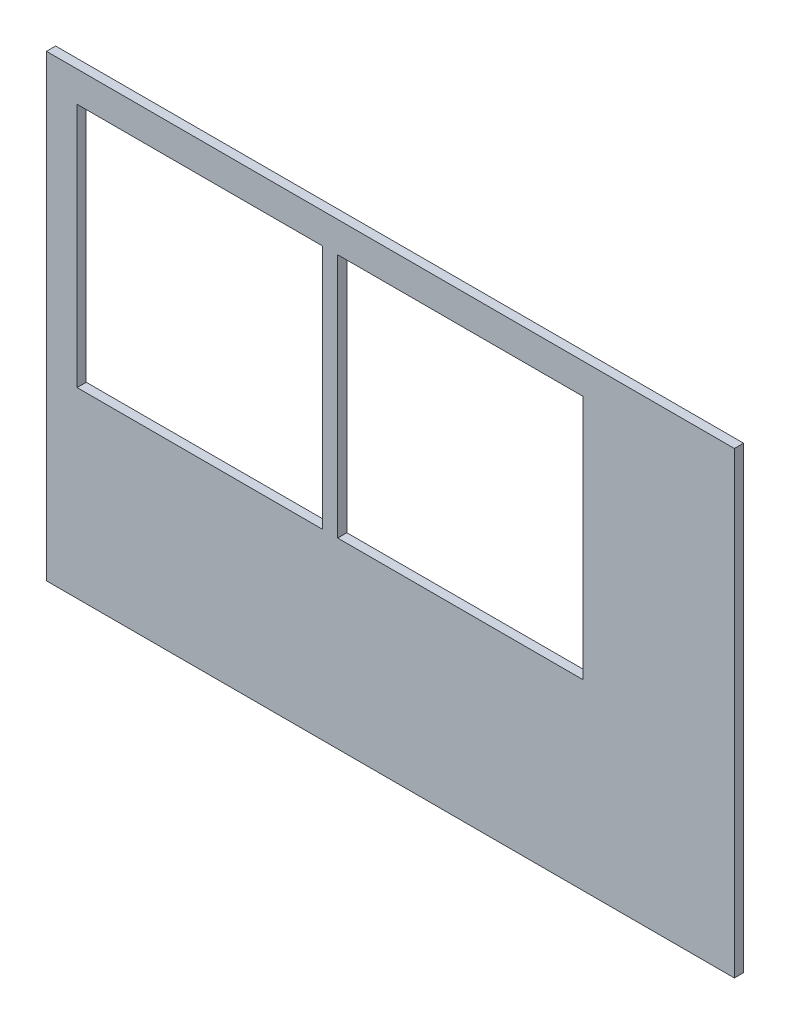
from build123d import *

# Parameters (mm, degrees)
SKETCH1_W           = 900
SKETCH1_H           = 600
SKETCH1_W_2         = 321
SKETCH1_H_2         = 321
BOSS_EXTRUDE1_DEPTH = 12


with BuildPart() as part:
    # Sketch1 → Boss-Extrude1 (new body)
    with BuildSketch(Plane.XY):
        with Locations((985.346938776, 300)):
            Rectangle(SKETCH1_W, SKETCH1_H)
        with Locations((1076.846938776, 399.5)):
            Rectangle(SKETCH1_W_2, SKETCH1_H_2, mode=Mode.SUBTRACT)
        with Locations((735.846938776, 399.5)):
            Rectangle(SKETCH1_W_2, SKETCH1_H_2, mode=Mode.SUBTRACT)
    extrude(amount=BOSS_EXTRUDE1_DEPTH)


solid = part.part
